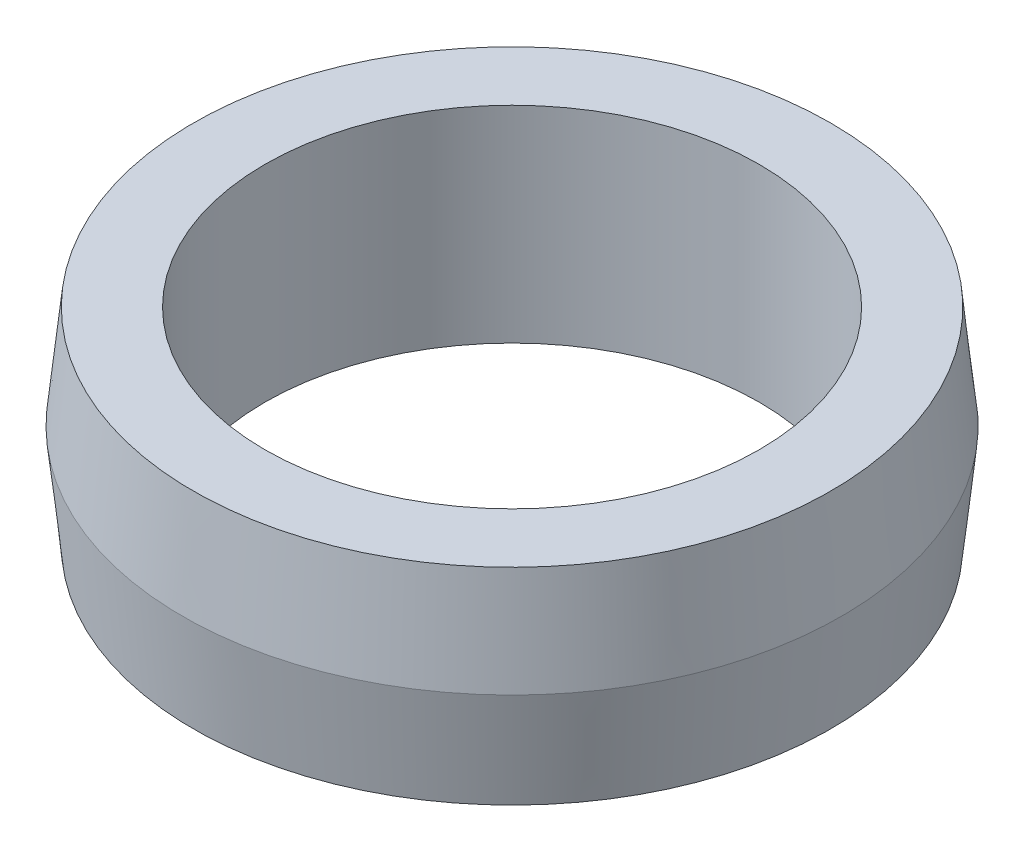
from build123d import *

# Parameters (mm, degrees)
CROQUIS1_R              = 50.8
CROQUIS1_R_2            = 38.1
SALIENTE_EXTRUIR1_DEPTH = 31.75


with BuildPart() as part:
    # Croquis1 → Saliente-Extruir1 (new body)
    with BuildSketch(Plane(origin=(0, 0, 0), x_dir=(1, 0, 0), z_dir=(0, 1, 0))):
        with Locations(Location((0, 0, 0), (0, 0, 270))):
            Circle(CROQUIS1_R)
        with Locations(Location((0, 0, 0), (0, 0, 270))):
            Circle(CROQUIS1_R_2, mode=Mode.SUBTRACT)
    extrude(amount=SALIENTE_EXTRUIR1_DEPTH)

    # Croquis3 → Cortar-Revolución1 (revolve, cut)
    with BuildSketch(Plane(origin=(0, 0, 0), x_dir=(0, 0, -1), z_dir=(1, 0, 0)), mode=Mode.PRIVATE) as cortar_revoluci_n1_sk:
        Polygon((-50.8, 15.875), (-49.131470265, 31.75), (-69.131470265, 31.75), (-69.131470265, 0), (-49.131470265, 0), align=None)
    revolve(cortar_revoluci_n1_sk.sketch.rotate(Axis((0, 0, 0), (0, 1, 0)), 180), axis=Axis((0, 0, 0), (0, 1, 0)), mode=Mode.SUBTRACT)


solid = part.part
